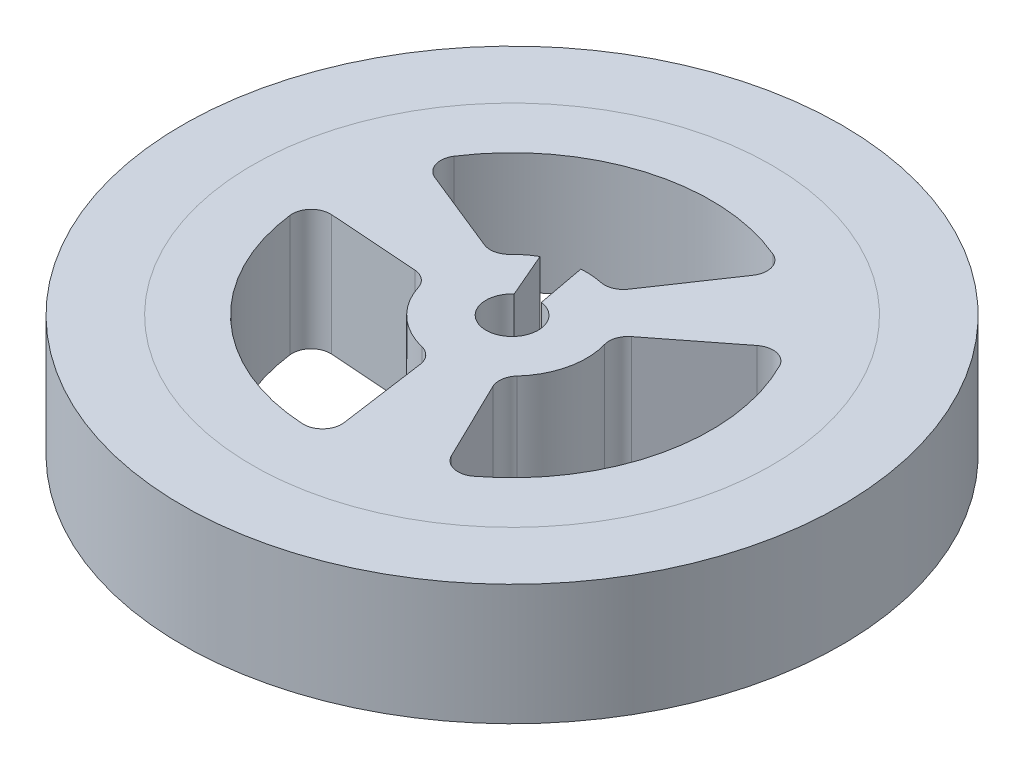
from build123d import *

# Parameters (mm, degrees)
SKETCH1_R           = 13.595
SKETCH1_R_2         = 10.415
BOSS_EXTRUDE1_DEPTH = 6.32
SKETCH2_W           = 1.9
SKETCH2_H           = 3.18
SKETCH3_R           = 3.9
BOSS_EXTRUDE2_DEPTH = 6.32
SKETCH4_R           = 3.9
BOSS_EXTRUDE3_DEPTH = 2.31
SKETCH5_R           = 1.365
CUT_EXTRUDE1_DEPTH  = 8.63
BOSS_EXTRUDE4_START = -6.32
BOSS_EXTRUDE4_DEPTH = 6.32
CIRPATTERN2_COUNT   = 3
FILLET2_R           = 1
FILLET3_R           = 1
CUT_EXTRUDE2_DEPTH  = 25.31


with BuildPart() as part:
    # Sketch1 → Boss-Extrude1 (new body)
    with BuildSketch(Plane(origin=(0, 0, 0), x_dir=(1, 0, 0), z_dir=(0, 1, 0))):
        with Locations(Location((0, 0, 0), (0, 0, 90))):
            Circle(SKETCH1_R)
        with Locations(Location((0, 0, 0), (0, 0, 90))):
            Circle(SKETCH1_R_2, mode=Mode.SUBTRACT)
    extrude(amount=BOSS_EXTRUDE1_DEPTH)

    # Sketch2 → Revolve1 (revolve)
    with BuildSketch(Plane.XY, mode=Mode.PRIVATE) as revolve1_sk:
        with Locations((-14.545, 3.16)):
            Rectangle(SKETCH2_W, SKETCH2_H)
    revolve(revolve1_sk.sketch.rotate(Axis((0, 0, 0), (0, 1, 0)), 270), axis=Axis((0, 0, 0), (0, 1, 0)))



with BuildPart() as body_2:
    # Sketch3 → Boss-Extrude2 (new body)
    with BuildSketch(Plane(origin=(0, 6.32, 0), x_dir=(1, 0, 0), z_dir=(0, 1, 0))):
        with Locations(Location((0, 0, 0), (0, 0, 270))):
            Circle(SKETCH3_R)
    extrude(amount=-BOSS_EXTRUDE2_DEPTH)

    # Sketch4 → Boss-Extrude3 (add)
    with BuildSketch(Plane.XZ):
        with Locations(Location((0, 0, 0), (0, 0, 90))):
            Circle(SKETCH4_R)
    extrude(amount=BOSS_EXTRUDE3_DEPTH)

    # Sketch5 → Cut-Extrude1 (cut)
    with BuildSketch(Plane(origin=(0, 6.32, 0), x_dir=(1, 0, 0), z_dir=(0, 1, 0))):
        with Locations(Location((0, 0, 0), (0, 0, 270))):
            Circle(SKETCH5_R)
    extrude(amount=-CUT_EXTRUDE1_DEPTH, mode=Mode.SUBTRACT)


with BuildPart() as part_1:
    add(part.part)

    add(body_2.part)  # Boss-Extrude4 merges body 2
    # Sketch6 → Boss-Extrude4 (add)
    with BuildSketch(Plane(origin=(0, 6.32, 0), x_dir=(1, 0, 0), z_dir=(0, 1, 0)).offset(BOSS_EXTRUDE4_START)):
        with BuildLine():
            Line((5.134171789, 9.06159506), (1.457981988, 3.617221105))
            ThreePointArc((1.457981988, 3.617221105), (2.66219063, 2.850042289), (3.509570899, 1.700856286))
            Line((3.509570899, 1.700856286), (8.68650056, 5.746036288))
            ThreePointArc((8.68650056, 5.746036288), (7.106404051, 7.61388511), (5.134171789, 9.06159506))
        make_face()
    boss_extrude4 = extrude(amount=BOSS_EXTRUDE4_DEPTH)

    # CirPattern2: Boss-Extrude4 ×3 about axis
    cirpattern2_axis = Axis((0, 0, 0), (0, 1, 0))
    for i in range(1, CIRPATTERN2_COUNT):
        add(boss_extrude4.rotate(cirpattern2_axis, i * 360 / CIRPATTERN2_COUNT))

    # Fillet2
    fillet2_edges = [part_1.edges().sort_by_distance(p)[0] for p in [
        (0.632963116, 3.16, 10.395748299),
    ]]
    fillet(fillet2_edges, radius=FILLET2_R)

    # Fillet3
    fillet3_edges = [part_1.edges().sort_by_distance(p)[0] for p in [
        (5.134171789, 3.16, -9.06159506),
        (8.68650056, 3.16, -5.746036288),
        (3.509570899, 3.16, -1.700856286),
        (1.457981988, 3.16, -3.617221105),
        (-10.414657416, 3.16, 0.084474334),
        (-9.319463676, 3.16, -4.649712011),
        (-3.227770201, 3.16, -2.188949412),
        (-3.861596362, 3.16, 0.545961112),
        (5.280485627, 3.16, 8.977120727),
        (-0.281800697, 3.16, 3.889805698),
        (2.403614374, 3.16, 3.071259993),
    ]]
    fillet(fillet3_edges, radius=FILLET3_R)

    # Sketch7 → Cut-Extrude2 (cut)
    with BuildSketch(Plane(origin=(0, 6.32, 0), x_dir=(1, 0, 0), z_dir=(0, 1, 0))):
        with BuildLine():
            Line((-1.927864704, 3.390182544), (-0.907405589, 1.019725501))
            ThreePointArc((-0.907405589, 1.019725501), (-0.398121955, 1.305650761), (0.184050667, 1.352534788))
            Line((0.184050667, 1.352534788), (-0.291742117, 3.889072709))
            ThreePointArc((-0.291742117, 3.889072709), (-1.1374913, 3.730430745), (-1.927864704, 3.390182544))
        make_face()
    extrude(amount=-CUT_EXTRUDE2_DEPTH, mode=Mode.SUBTRACT)


with BuildPart() as body_2_2:
    # Sketch8 → Revolve4 (revolve)
    with BuildSketch(Plane.XY, mode=Mode.PRIVATE) as revolve4_sk:
        Polygon((-13.595, 4.75), (-15.495, 4.75), (-15.495, 1.57), (-13.595, 1.57), (-13.595, 0), (-17.242346631, 0), (-17.242346631, 6.32), (-13.595, 6.32), align=None)
    revolve(revolve4_sk.sketch.rotate(Axis((0, 0, 0), (0, 1, 0)), 270), axis=Axis((0, 0, 0), (0, 1, 0)))


solid = Compound([part_1.part, body_2_2.part])
